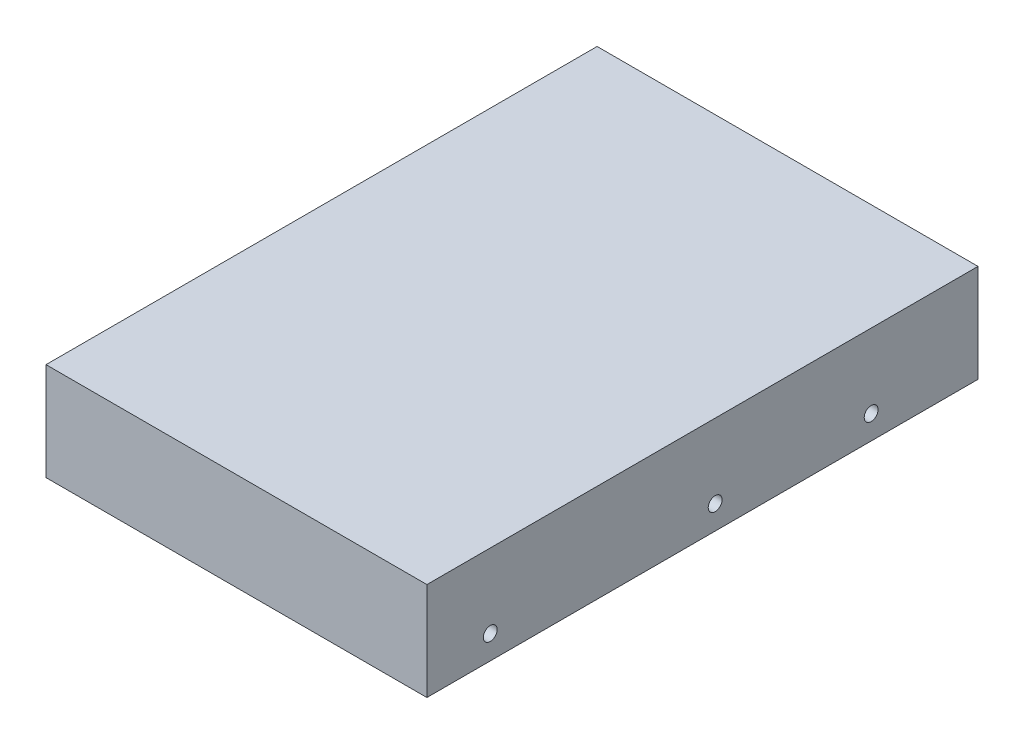
from build123d import *

# Parameters (mm, degrees)
SKETCH_1_W                   = 101.6
SKETCH_1_H                   = 147
EXTRUDE_1_DEPTH              = 26.1
HOLE_WIZARD_M3_51_AT_2_COUNT = 2
HOLE_WIZARD_M3_51_AT_2_PITCH = 59.99
HOLE_WIZARD_M3_51_AT_3_COUNT = 2
HOLE_WIZARD_M3_51_AT_3_PITCH = 101.6


with BuildPart() as part:
    # Эскиз1 → Бобышка-Вытянуть1 (new body)
    with BuildSketch(Plane(origin=(0, 0, 0), x_dir=(1, 0, 0), z_dir=(0, 1, 0))):
        with Locations((50.8, 73.5)):
            Rectangle(SKETCH_1_W, SKETCH_1_H)
    extrude(amount=EXTRUDE_1_DEPTH)

    # Эскиз5 → Сверло под метчик  спиральное M3.51 (revolve, cut)
    with BuildSketch(Plane(origin=(101.6, 6.35, -16.9), x_dir=(0, 0, -1), z_dir=(0, 1, 0))):
        Polygon((0, 0), (0, 5.611592145), (1.85, 4.5), (1.85, 0), align=None)
    hole_wizard_m3_51 = revolve(axis=Axis((107.95, 6.35, -16.9), (-1, 0, 0)), mode=Mode.SUBTRACT)

    # Сверло под метчик  спиральное M3.51 at 2: Сверло под метчик  спиральное M3.51 ×2
    with Locations(*[(0, 0, -i * HOLE_WIZARD_M3_51_AT_2_PITCH) for i in range(1, HOLE_WIZARD_M3_51_AT_2_COUNT)]):
        add(hole_wizard_m3_51, mode=Mode.SUBTRACT)

    # Сверло под метчик  спиральное M3.51 at 3: Сверло под метчик  спиральное M3.51 ×2
    with Locations(*[(0, 0, -i * HOLE_WIZARD_M3_51_AT_3_PITCH) for i in range(1, HOLE_WIZARD_M3_51_AT_3_COUNT)]):
        add(hole_wizard_m3_51, mode=Mode.SUBTRACT)

    # Зеркальное отражение1: Сверло под метчик  спиральное M3.51 across plane
    add(hole_wizard_m3_51.mirror(Plane.ZY.offset(-50.8)), mode=Mode.SUBTRACT)

    # Зеркальное отражение1 copy 1 sketch → Зеркальное отражение1 copy 1 (revolve, cut)
    with BuildSketch(Plane(origin=(0, 6.35, -76.89), x_dir=(0, 0, -1), z_dir=(0, 1, 0))):
        Polygon((0, 0), (0, -5.611592145), (1.85, -4.5), (1.85, 0), align=None)
    revolve(axis=Axis((-6.35, 6.35, -76.89), (-1, 0, 0)), mode=Mode.SUBTRACT)

    # Зеркальное отражение1 copy 2 sketch → Зеркальное отражение1 copy 2 (revolve, cut)
    with BuildSketch(Plane(origin=(0, 6.35, -118.5), x_dir=(0, 0, -1), z_dir=(0, 1, 0))):
        Polygon((0, 0), (0, -5.611592145), (1.85, -4.5), (1.85, 0), align=None)
    revolve(axis=Axis((-6.35, 6.35, -118.5), (-1, 0, 0)), mode=Mode.SUBTRACT)


solid = part.part
